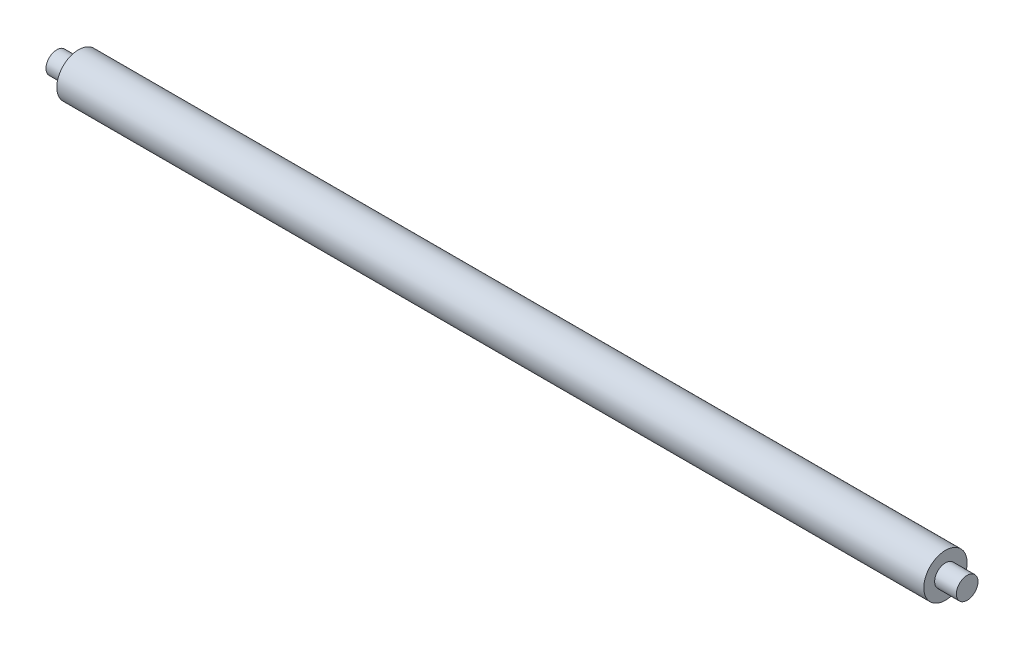
from build123d import *

# Parameters (mm, degrees)
SKETCH1_R           = 5
BOSS_EXTRUDE1_DEPTH = 100
SKETCH2_R           = 2.5
BOSS_EXTRUDE2_DEPTH = 5


with BuildPart() as part:
    # Sketch1 → Boss-Extrude1 (new, symmetric)
    with BuildSketch(Plane(origin=(0, 0, 0), x_dir=(0, 0, -1), z_dir=(1, 0, 0))):
        Circle(SKETCH1_R)
    extrude(amount=BOSS_EXTRUDE1_DEPTH, both=True)

    # Sketch2 → Boss-Extrude2 (add)
    with BuildSketch(Plane(origin=(100, 0, 0), x_dir=(0, 0, -1), z_dir=(1, 0, 0))):
        Circle(SKETCH2_R)
    boss_extrude2 = extrude(amount=BOSS_EXTRUDE2_DEPTH)

    # Mirror1: Boss-Extrude2 across plane
    add(boss_extrude2.mirror(Plane(origin=(0, 0, 0), x_dir=(0, 0, 1), z_dir=(1, 0, 0))))


solid = part.part
